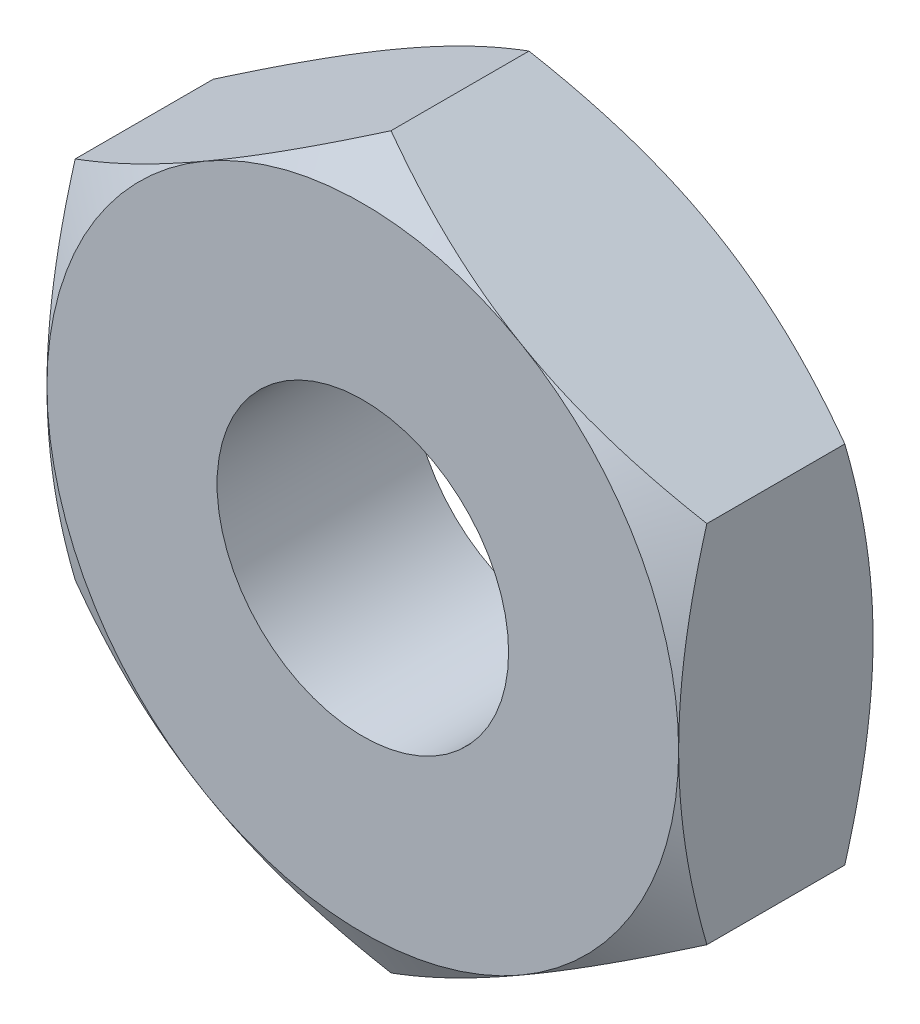
from build123d import *

# Parameters (mm, degrees)
SKETCH1_R           = 6
BOSS_EXTRUDE1_DEPTH = 8
SKETCH5_OUTSIDE_W   = 91.528
SKETCH5_OUTSIDE_H   = 95.55
SKETCH5_OUTSIDE_R   = 13
CUT_EXTRUDE5_DEPTH  = 16
CUT_EXTRUDE5_DRAFT  = -60
SKETCH6_OUTSIDE_W   = 91.528
SKETCH6_OUTSIDE_H   = 95.55
SKETCH6_OUTSIDE_R   = 13
CUT_EXTRUDE6_DEPTH  = 16
CUT_EXTRUDE6_DRAFT  = -60


with BuildPart() as part:
    # Sketch1 → Boss-Extrude1 (new body)
    with BuildSketch(Plane.XY):
        Polygon((0, 15.011106999), (-13, 7.505553499), (-13, -7.505553499), (0, -15.011106999), (13, -7.505553499), (13, 7.505553499), align=None)
        Circle(SKETCH1_R, mode=Mode.SUBTRACT)
    extrude(amount=BOSS_EXTRUDE1_DEPTH)


with BuildPart() as cut_extrude5_tool:
    # Sketch5 outside → Cut-Extrude5 (with draft: the straight prism first)
    with BuildSketch(Plane(origin=(0, 0, 0), x_dir=(-1, 0, 0), z_dir=(0, 0, -1))):
        Rectangle(SKETCH5_OUTSIDE_W, SKETCH5_OUTSIDE_H)
        Circle(SKETCH5_OUTSIDE_R, mode=Mode.SUBTRACT)
    extrude(amount=-CUT_EXTRUDE5_DEPTH)
    # Cut-Extrude5: the draft: its side faces are tilted about the plane it starts from
    cut_extrude5_sides = [cut_extrude5_tool.faces().sort_by_distance(p)[0] for p in [
        (0, -47.775, 8),
        (-45.764, 0, 8),
        (0, 47.775, 8),
        (45.764, 0, 8),
        (13, 0, 8),
    ]]
    draft(cut_extrude5_sides, Plane(origin=(0, 0, 0), x_dir=(-1, 0, 0), z_dir=(0, 0, -1)), CUT_EXTRUDE5_DRAFT)


with BuildPart() as part_1:
    add(part.part)

    # Cut-Extrude5: cut by cut_extrude5_tool
    add(cut_extrude5_tool.part, mode=Mode.SUBTRACT)


with BuildPart() as cut_extrude6_tool:
    # Sketch6 outside → Cut-Extrude6 (with draft: the straight prism first)
    with BuildSketch(Plane.XY.offset(8)):
        Rectangle(SKETCH6_OUTSIDE_W, SKETCH6_OUTSIDE_H)
        Circle(SKETCH6_OUTSIDE_R, mode=Mode.SUBTRACT)
    extrude(amount=-CUT_EXTRUDE6_DEPTH)
    # Cut-Extrude6: the draft: its side faces are tilted about the plane it starts from
    cut_extrude6_sides = [cut_extrude6_tool.faces().sort_by_distance(p)[0] for p in [
        (0, -47.775, 0),
        (45.764, 0, 0),
        (0, 47.775, 0),
        (-45.764, 0, 0),
        (-13, 0, 0),
    ]]
    draft(cut_extrude6_sides, Plane.XY.offset(8), CUT_EXTRUDE6_DRAFT)


with BuildPart() as part_2:
    add(part_1.part)

    # Cut-Extrude6: cut by cut_extrude6_tool
    add(cut_extrude6_tool.part, mode=Mode.SUBTRACT)


solid = part_2.part
